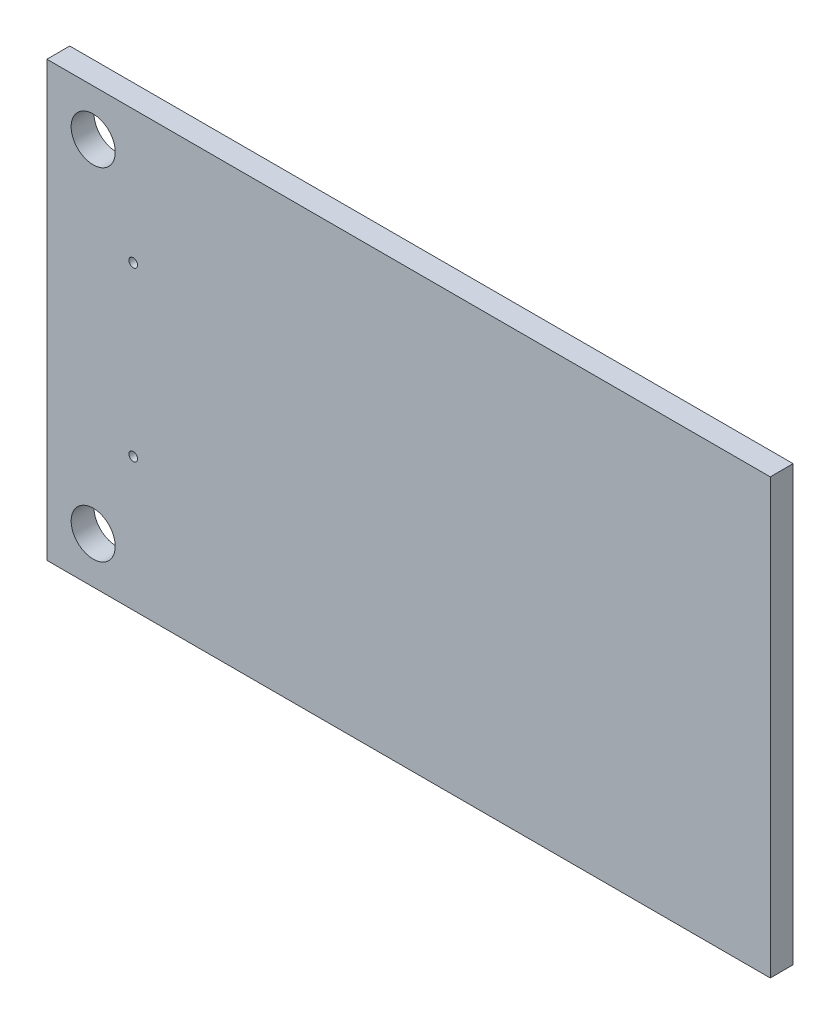
from build123d import *

# Parameters (mm, degrees)
SKETCH1_W           = 50
SKETCH1_H           = 30
SKETCH1_R           = 1.524
SKETCH1_R_2         = 0.3
BOSS_EXTRUDE1_DEPTH = 1.58


with BuildPart() as part:
    # Sketch1 → Boss-Extrude1 (new body)
    with BuildSketch(Plane.XY):
        Rectangle(SKETCH1_W, SKETCH1_H)
        with Locations(Location((-21.8, 11.8, 0), (0, 0, 180))):
            Circle(SKETCH1_R, mode=Mode.SUBTRACT)
        with Locations(Location((-21.8, -11.8, 0), (0, 0, 180))):
            Circle(SKETCH1_R, mode=Mode.SUBTRACT)
        with Locations((-19.032, 5.8)):
            Circle(SKETCH1_R_2, mode=Mode.SUBTRACT)
        with Locations((-19.032, -5.8)):
            Circle(SKETCH1_R_2, mode=Mode.SUBTRACT)
    extrude(amount=BOSS_EXTRUDE1_DEPTH)


solid = part.part
